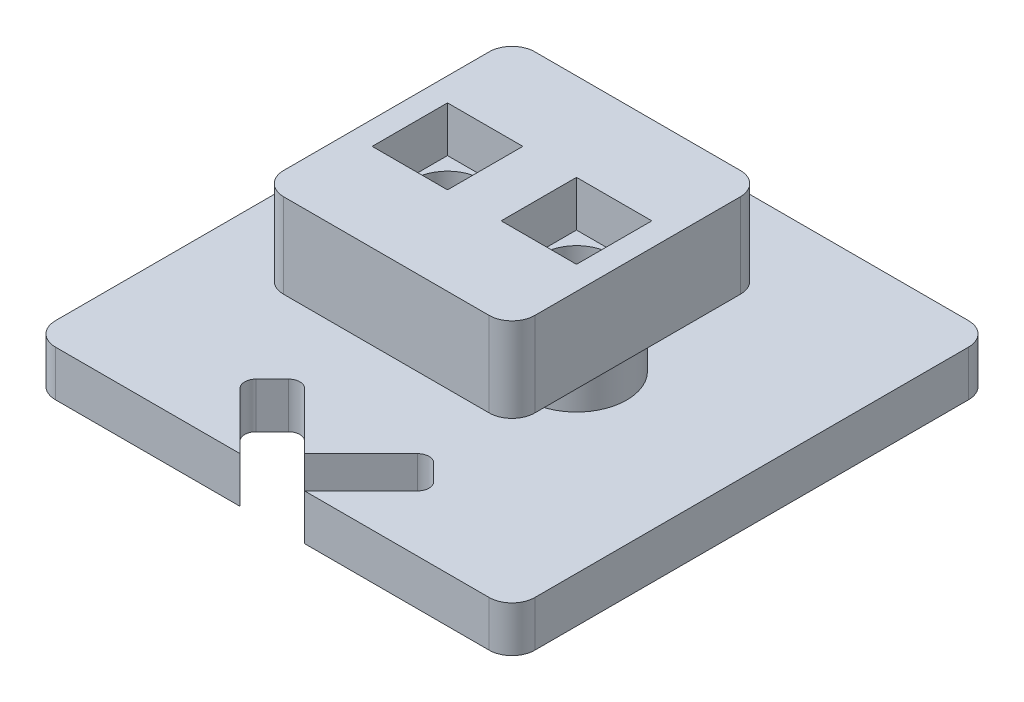
from build123d import *

# Parameters (mm, degrees)
SKETCH1_W           = 11
SKETCH1_H           = 11
BOSS_EXTRUDE1_DEPTH = 3.7
FILLET1_R           = 1
SKETCH2_W           = 3.3
SKETCH2_H           = 3.3
CUT_EXTRUDE1_DEPTH  = 2
SKETCH4_R           = 2.2
BOSS_EXTRUDE2_DEPTH = 4
BOSS_EXTRUDE3_DEPTH = 2
SKETCH3_R           = 1.5
CUT_EXTRUDE2_DEPTH  = 17.726924403
CUT_EXTRUDE3_DEPTH  = 16.90565937


with BuildPart() as part:
    # Sketch1 → Boss-Extrude1 (new body)
    with BuildSketch(Plane(origin=(0, 0, 0), x_dir=(1, 0, 0), z_dir=(0, 1, 0))):
        Rectangle(SKETCH1_W, SKETCH1_H)
    extrude(amount=BOSS_EXTRUDE1_DEPTH)

    # Fillet1
    fillet1_edges = [part.edges().sort_by_distance(p)[0] for p in [
        (5.5, 1.85, 5.5),
        (-5.5, 1.85, 5.5),
        (-5.5, 1.85, -5.5),
        (5.5, 1.85, -5.5),
    ]]
    fillet(fillet1_edges, radius=FILLET1_R)

    # Sketch2 → Cut-Extrude1 (cut)
    with BuildSketch(Plane(origin=(0, 3.7, 0), x_dir=(1, 0, 0), z_dir=(0, 1, 0))):
        with Locations((-2.825, 0)):
            Rectangle(SKETCH2_W, SKETCH2_H)
        with Locations((2.825, 0)):
            Rectangle(SKETCH2_W, SKETCH2_H)
    extrude(amount=-CUT_EXTRUDE1_DEPTH, mode=Mode.SUBTRACT)

    # Sketch4 → Boss-Extrude2 (add)
    with BuildSketch(Plane(origin=(0, 0, 0), x_dir=(-1, 0, 0), z_dir=(0, -1, 0))):
        with Locations(Location((2.825, 0, 0), (0, 0, 90))):
            Circle(SKETCH4_R)
        with Locations(Location((-2.825, 0, 0), (0, 0, 90))):
            Circle(SKETCH4_R)
    extrude(amount=BOSS_EXTRUDE2_DEPTH)

    # Sketch5 → Boss-Extrude3 (add)
    with BuildSketch(Plane(origin=(0, -4, 0), x_dir=(-1, 0, 0), z_dir=(0, -1, 0))):
        with BuildLine():
            Line((9.5, 10.5), (-9.5, 10.5))
            ThreePointArc((-9.5, 10.5), (-10.207106781, 10.207106781), (-10.5, 9.5))
            Line((-10.5, 9.5), (-10.5, -9.5))
            ThreePointArc((-10.5, -9.5), (-10.207106781, -10.207106781), (-9.5, -10.5))
            Line((-9.5, -10.5), (9.5, -10.5))
            ThreePointArc((9.5, -10.5), (10.207106781, -10.207106781), (10.5, -9.5))
            Line((10.5, -9.5), (10.5, 9.5))
            ThreePointArc((10.5, 9.5), (10.207106781, 10.207106781), (9.5, 10.5))
        make_face()
    extrude(amount=-BOSS_EXTRUDE3_DEPTH)

    # Sketch3 → Cut-Extrude2 (cut, through all)
    with BuildSketch(Plane(origin=(0, 3.7, 0), x_dir=(1, 0, 0), z_dir=(0, 1, 0))):
        with Locations(Location((-2.825, 0, 0), (0, 0, 270))):
            Circle(SKETCH3_R)
        with Locations(Location((2.825, 0, 0), (0, 0, 270))):
            Circle(SKETCH3_R)
    extrude(amount=-CUT_EXTRUDE2_DEPTH, mode=Mode.SUBTRACT)

    # Sketch7 → Cut-Extrude3 (cut, through all)
    with BuildSketch(Plane(origin=(0, -2, 0), x_dir=(1, 0, 0), z_dir=(0, 1, 0))):
        with BuildLine():
            Line((0, -9.085786438), (1.414213562, -10.5))
            Line((1.414213562, -10.5), (3.889087297, -8.025126266))
            ThreePointArc((3.889087297, -8.025126266), (4.035533906, -7.671572875), (3.889087297, -7.318019485))
            Line((3.889087297, -7.318019485), (3.181980515, -6.610912703))
            ThreePointArc((3.181980515, -6.610912703), (2.828427125, -6.464466094), (2.474873734, -6.610912703))
            Line((2.474873734, -6.610912703), (0, -9.085786438))
        make_face()
        with BuildLine():
            Line((-3.889087297, -8.025126266), (-1.414213562, -10.5))
            Line((-1.414213562, -10.5), (0, -9.085786438))
            Line((0, -9.085786438), (-2.474873734, -6.610912703))
            ThreePointArc((-2.474873734, -6.610912703), (-2.828427125, -6.464466094), (-3.181980515, -6.610912703))
            Line((-3.181980515, -6.610912703), (-3.889087297, -7.318019485))
            ThreePointArc((-3.889087297, -7.318019485), (-4.035533906, -7.671572875), (-3.889087297, -8.025126266))
        make_face()
        Polygon((-1.414213562, -10.5), (1.414213562, -10.5), (0, -9.085786438), align=None)
    extrude(amount=-CUT_EXTRUDE3_DEPTH, mode=Mode.SUBTRACT)


solid = part.part
